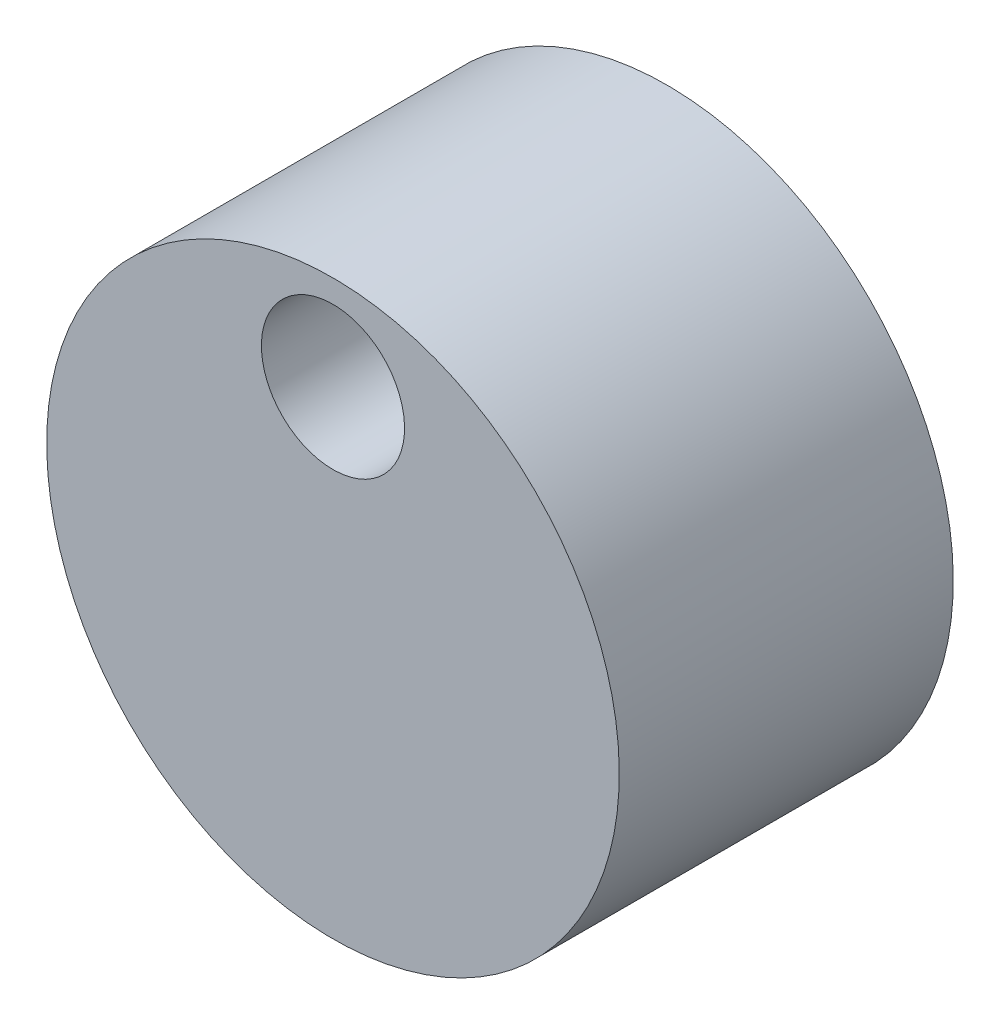
from build123d import *

# Parameters (mm, degrees)
ESQUISSE2_RX       = 12.7
ESQUISSE2_RY       = 12.7
ESQUISSE2_RX_2     = 3.175
ESQUISSE2_RY_2     = 3.175
BOSS_EXTRU_2_DEPTH = 14.81582


with BuildPart() as part:
    # Esquisse2 → Boss.-Extru.2 (new body)
    with BuildSketch(Plane.XY):
        with Locations(Location((0, 0), (0, 0, -139.363511392))):
            Ellipse(ESQUISSE2_RX, ESQUISSE2_RY)
        with Locations(Location((0, 8.509), (0, 0, 32.73784229))):
            Ellipse(ESQUISSE2_RX_2, ESQUISSE2_RY_2, mode=Mode.SUBTRACT)
    extrude(amount=BOSS_EXTRU_2_DEPTH)


solid = part.part
